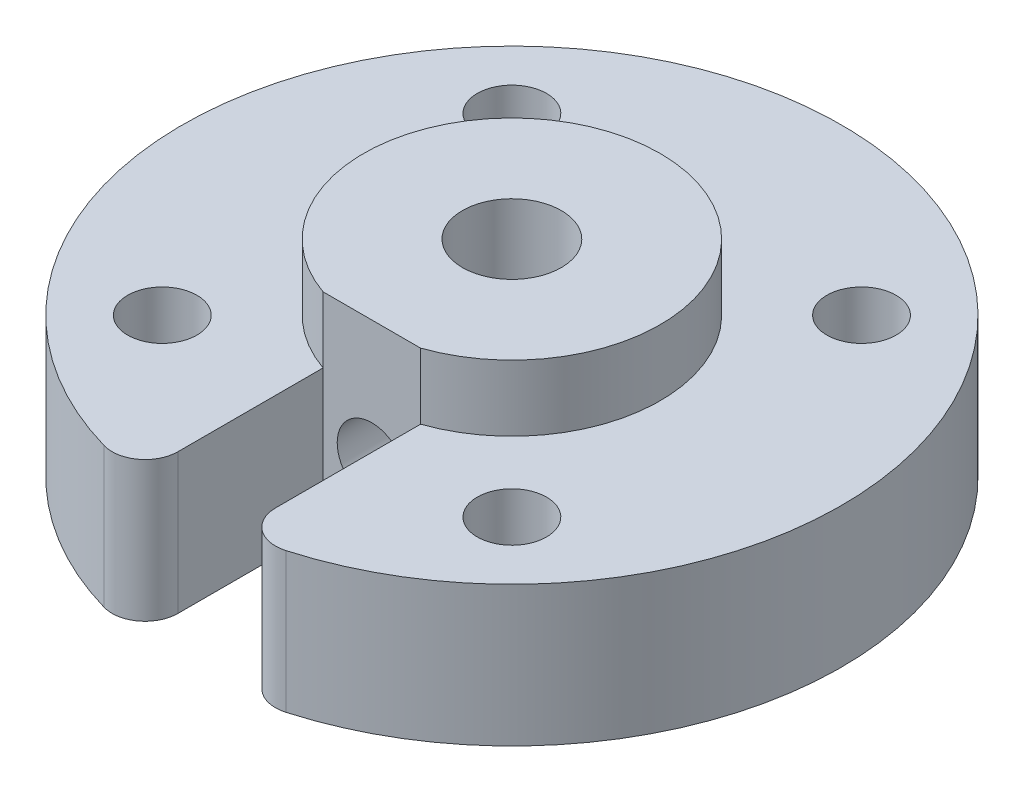
from build123d import *

# Parameters (mm, degrees)
SKETCH1_R                  = 9
SKETCH1_R_2                = 3
BOSS_EXTRUDE1_DEPTH        = 12.5
SKETCH5_W                  = 2.1
SKETCH5_H                  = 9
CUT_EXTRUDE1_START         = 9
SKETCH6_W                  = 18
SKETCH6_H                  = 12.5
CUT_EXTRUDE1_DEPTH         = 0.5
BOSS_EXTRUDE2_DEPTH        = 8.5
FILLET1_R                  = 2
F_4_2_4_2_DIAMETER_HOLE2_D = 4.2


with BuildPart() as part:
    # Sketch1 → Boss-Extrude1 (new body)
    with BuildSketch(Plane(origin=(0, 0, 0), x_dir=(1, 0, 0), z_dir=(0, 1, 0))):
        with Locations(Location((0, 0, 0), (0, 0, 270))):
            Circle(SKETCH1_R)
        with Locations(Location((0, 0, 0), (0, 0, 270))):
            Circle(SKETCH1_R_2, mode=Mode.SUBTRACT)
    extrude(amount=BOSS_EXTRUDE1_DEPTH)

    # Sketch5 → Ø4.2 (4.2) Diameter Hole1 (revolve, cut)
    with BuildSketch(Plane(origin=(0, 5, 0), x_dir=(0, 1, 0), z_dir=(1, 0, 0))):
        with Locations((1.05, 4.5)):
            Rectangle(SKETCH5_W, SKETCH5_H)
    revolve(axis=Axis((0, 5, -6.35), (0, 0, 1)), mode=Mode.SUBTRACT)

    # Sketch6 → Cut-Extrude1 (cut)
    with BuildSketch(Plane.XY.offset(CUT_EXTRUDE1_START)):
        with Locations((0, 6.25)):
            Rectangle(SKETCH6_W, SKETCH6_H)
    extrude(amount=-CUT_EXTRUDE1_DEPTH, mode=Mode.SUBTRACT)

    # Sketch7 → Boss-Extrude2 (add)
    with BuildSketch(Plane.XZ):
        with BuildLine():
            Line((-2.958039892, 8.5), (-2.958039892, 19.780040445))
            ThreePointArc((-2.958039892, 19.780040445), (0, -20), (2.958039892, 19.780040445))
            Line((2.958039892, 19.780040445), (2.958039892, 8.5))
            ThreePointArc((2.958039892, 8.5), (0, -9), (-2.958039892, 8.5))
        make_face()
    extrude(amount=-BOSS_EXTRUDE2_DEPTH)

    # Fillet1
    fillet1_edges = [part.edges().sort_by_distance(p)[0] for p in [
        (-2.958039892, 4.25, 19.780040445),
        (2.958039892, 4.25, 19.780040445),
    ]]
    fillet(fillet1_edges, radius=FILLET1_R)

    # Ø4.2 (4.2) Diameter Hole2 (through all)
    with Locations(Plane(origin=(0, 0, 0), x_dir=(-1, 0, 0), z_dir=(0, -1, 0))):
        with Locations((10.606601718, -10.606601718), (-10.606601718, -10.606601718), (-10.606601718, 10.606601718), (10.606601718, 10.606601718)):
            Hole(F_4_2_4_2_DIAMETER_HOLE2_D / 2)


solid = part.part
